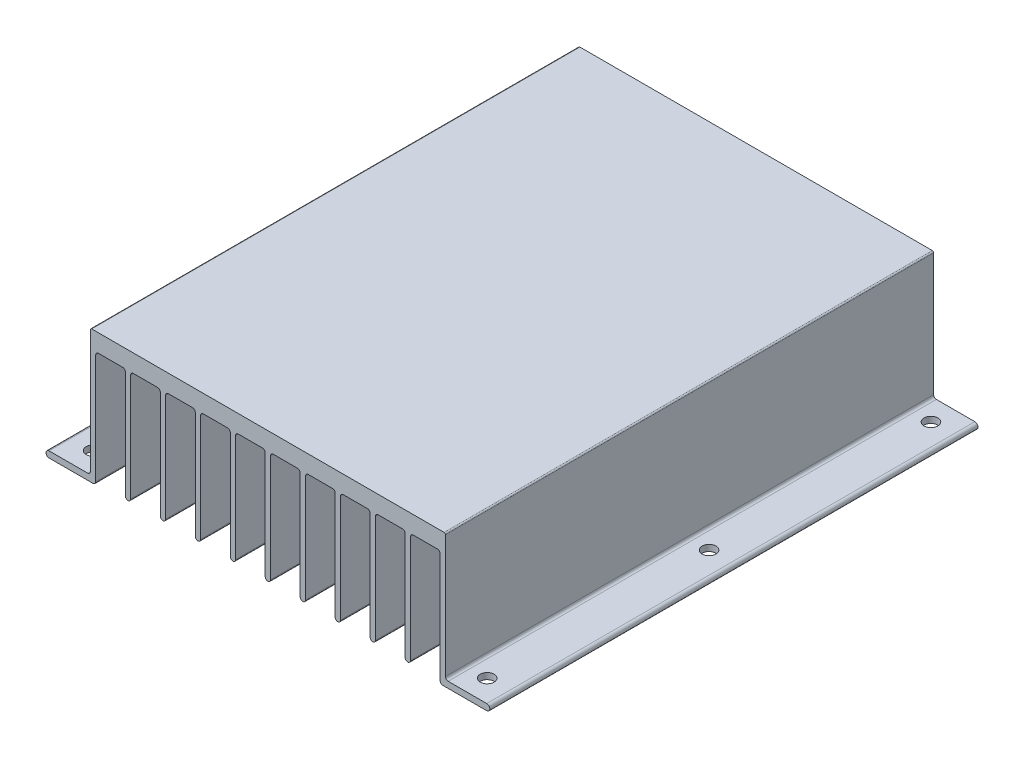
from build123d import *

# Parameters (mm, degrees)
BOSS_EXTRUDE1_DEPTH                 = 139.7
F_5_32_0_15625_DIAMETER_HOLE1_D     = 3.96875
F_5_32_0_15625_DIAMETER_HOLE1_DEPTH = 38.100461051
FILLET1_R                           = 0.381
FILLET2_R                           = 0.7874


with BuildPart() as part:
    # Sketch1 → Boss-Extrude1 (new body)
    with BuildSketch(Plane.XY):
        with BuildLine():
            Line((62.610769474, -36.322), (50.8, -36.322))
            Line((50.8, -36.322), (50.8, 0))
            Line((50.8, 0), (-50.8, 0))
            Line((-50.8, 0), (-50.8, -36.322))
            Line((-50.8, -36.322), (-62.610769474, -36.322))
            ThreePointArc((-62.610769474, -36.322), (-63.5, -37.211230526), (-62.610769474, -38.100461051))
            Line((-62.610769474, -38.100461051), (-49.276, -38.100461051))
            Line((-49.276, -38.100461051), (-49.276, -5.080461051))
            Line((-49.276, -5.080461051), (-40.7924, -5.080461051))
            Line((-40.7924, -5.080461051), (-40.7924, -36.576461051))
            ThreePointArc((-40.7924, -36.576461051), (-40.0304, -37.338461051), (-39.2684, -36.576461051))
            Line((-39.2684, -36.576461051), (-39.2684, -5.080461051))
            Line((-39.2684, -5.080461051), (-30.7848, -5.080461051))
            Line((-30.7848, -5.080461051), (-30.7848, -36.576461051))
            ThreePointArc((-30.7848, -36.576461051), (-30.0228, -37.338461051), (-29.2608, -36.576461051))
            Line((-29.2608, -36.576461051), (-29.2608, -5.080461051))
            Line((-29.2608, -5.080461051), (-20.7772, -5.080461051))
            Line((-20.7772, -5.080461051), (-20.7772, -36.576461051))
            ThreePointArc((-20.7772, -36.576461051), (-20.0152, -37.338461051), (-19.2532, -36.576461051))
            Line((-19.2532, -36.576461051), (-19.2532, -5.080461051))
            Line((-19.2532, -5.080461051), (-10.7696, -5.080461051))
            Line((-10.7696, -5.080461051), (-10.7696, -36.576461051))
            ThreePointArc((-10.7696, -36.576461051), (-10.0076, -37.338461051), (-9.2456, -36.576461051))
            Line((-9.2456, -36.576461051), (-9.2456, -5.080461051))
            Line((-9.2456, -5.080461051), (-0.762, -5.080461051))
            Line((-0.762, -5.080461051), (-0.762, -36.576461051))
            ThreePointArc((-0.762, -36.576461051), (0, -37.338461051), (0.762, -36.576461051))
            Line((0.762, -36.576461051), (0.762, -5.080461051))
            Line((0.762, -5.080461051), (9.2456, -5.080461051))
            Line((9.2456, -5.080461051), (9.2456, -36.576461051))
            ThreePointArc((9.2456, -36.576461051), (10.0076, -37.338461051), (10.7696, -36.576461051))
            Line((10.7696, -36.576461051), (10.7696, -5.080461051))
            Line((10.7696, -5.080461051), (19.2532, -5.080461051))
            Line((19.2532, -5.080461051), (19.2532, -36.576461051))
            ThreePointArc((19.2532, -36.576461051), (20.0152, -37.338461051), (20.7772, -36.576461051))
            Line((20.7772, -36.576461051), (20.7772, -5.080461051))
            Line((20.7772, -5.080461051), (29.2608, -5.080461051))
            Line((29.2608, -5.080461051), (29.2608, -36.576461051))
            ThreePointArc((29.2608, -36.576461051), (30.0228, -37.338461051), (30.7848, -36.576461051))
            Line((30.7848, -36.576461051), (30.7848, -5.080461051))
            Line((30.7848, -5.080461051), (39.2684, -5.080461051))
            Line((39.2684, -5.080461051), (39.2684, -36.576461051))
            ThreePointArc((39.2684, -36.576461051), (40.0304, -37.338461051), (40.7924, -36.576461051))
            Line((40.7924, -36.576461051), (40.7924, -5.080461051))
            Line((40.7924, -5.080461051), (49.276, -5.080461051))
            Line((49.276, -5.080461051), (49.276, -38.100461051))
            Line((49.276, -38.100461051), (62.610769474, -38.100461051))
            ThreePointArc((62.610769474, -38.100461051), (63.5, -37.211230526), (62.610769474, -36.322))
        make_face()
    extrude(amount=-BOSS_EXTRUDE1_DEPTH)

    # 5/32 (0.15625) Diameter Hole1
    with Locations(Plane(origin=(0, -38.100461051, 0), x_dir=(-1, 0, 0), z_dir=(0, -1, 0))):
        with Locations((56.388, 6.35), (56.388, 69.85), (56.388, 133.35), (-56.388, 6.35), (-56.388, 69.85), (-56.388, 133.35)):
            Hole(F_5_32_0_15625_DIAMETER_HOLE1_D / 2, depth=F_5_32_0_15625_DIAMETER_HOLE1_DEPTH)

    # Fillet1
    fillet1_edges = [part.edges().sort_by_distance(p)[0] for p in [
        (-50.8, 0, -69.85),
        (50.8, 0, -69.85),
    ]]
    fillet(fillet1_edges, radius=FILLET1_R)

    # Fillet2
    fillet2_edges = [part.edges().sort_by_distance(p)[0] for p in [
        (49.276, -38.100461051, -69.85),
        (49.276, -5.080461051, -69.85),
        (40.7924, -5.080461051, -69.85),
        (39.2684, -5.080461051, -69.85),
        (30.7848, -5.080461051, -69.85),
        (29.2608, -5.080461051, -69.85),
        (20.7772, -5.080461051, -69.85),
        (19.2532, -5.080461051, -69.85),
        (10.7696, -5.080461051, -69.85),
        (9.2456, -5.080461051, -69.85),
        (0.762, -5.080461051, -69.85),
        (-0.762, -5.080461051, -69.85),
        (-9.2456, -5.080461051, -69.85),
        (-10.7696, -5.080461051, -69.85),
        (-19.2532, -5.080461051, -69.85),
        (-20.7772, -5.080461051, -69.85),
        (-29.2608, -5.080461051, -69.85),
        (-30.7848, -5.080461051, -69.85),
        (-39.2684, -5.080461051, -69.85),
        (-40.7924, -5.080461051, -69.85),
        (-49.276, -5.080461051, -69.85),
        (-49.276, -38.100461051, -69.85),
        (-50.8, -36.322, -69.85),
        (50.8, -36.322, -69.85),
    ]]
    fillet(fillet2_edges, radius=FILLET2_R)


solid = part.part
